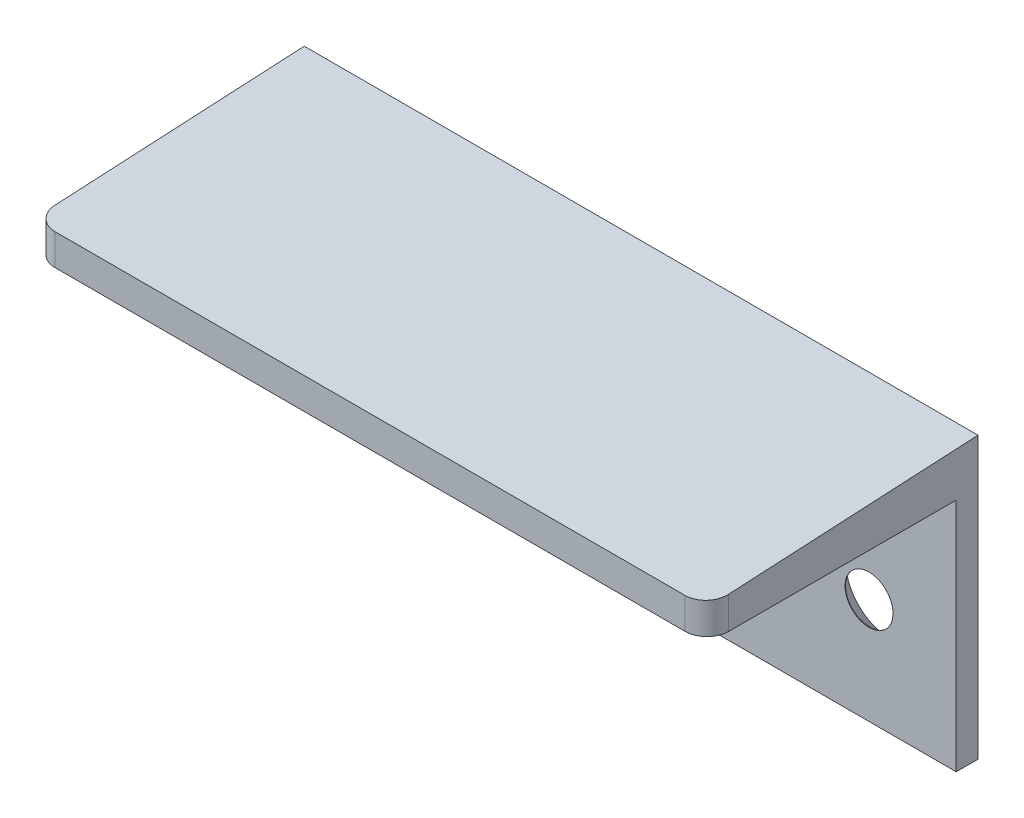
from build123d import *

# Parameters (mm, degrees)
SKETCH1_W                                       = 77.3
SKETCH1_H                                       = 32.2
BOSS_EXTRUDE1_DEPTH                             = 2.5
SKETCH3_W                                       = 77.3
SKETCH3_H                                       = 5.2
BOSS_EXTRUDE2_DEPTH                             = 28.599
FILLET1_R                                       = 2.5
SKETCH4_W                                       = 77.3
SKETCH4_H                                       = 37.342788029
CUT_REVOLVE2_ANGLE                              = 3
CSK_FOR_M5_FLAT_HEAD_MACHINE_SCREW1_D           = 5.5
CSK_FOR_M5_FLAT_HEAD_MACHINE_SCREW1_DEPTH       = 12.4
CSK_FOR_M5_FLAT_HEAD_MACHINE_SCREW1_CSINK_D     = 10.4
CSK_FOR_M5_FLAT_HEAD_MACHINE_SCREW1_CSINK_ANGLE = 90
CSK_FOR_M5_FLAT_HEAD_MACHINE_SCREW1_TIP         = 1.652366702


with BuildPart() as part:
    # Sketch1 → Boss-Extrude1 (new body)
    with BuildSketch(Plane.XY):
        Rectangle(SKETCH1_W, SKETCH1_H)
    extrude(amount=BOSS_EXTRUDE1_DEPTH)

    # Sketch3 → Boss-Extrude2 (add)
    with BuildSketch(Plane.XY.offset(2.5)):
        with Locations((0, 13.5)):
            Rectangle(SKETCH3_W, SKETCH3_H)
    extrude(amount=BOSS_EXTRUDE2_DEPTH)

    # Fillet1
    fillet1_edges = [part.edges().sort_by_distance(p)[0] for p in [
        (-38.65, 13.5, 31.099),
        (38.65, 13.5, 31.099),
    ]]
    fillet(fillet1_edges, radius=FILLET1_R)

    # Sketch4 → Cut-Revolve2 (revolve, cut)
    with BuildSketch(Plane(origin=(0, 16.1, 0), x_dir=(1, 0, 0), z_dir=(0, 1, 0))):
        with Locations((0, -18.671394015)):
            Rectangle(SKETCH4_W, SKETCH4_H)
    revolve(axis=Axis((-38.65, 16.1, 0), (1, 0, 0)), revolution_arc=CUT_REVOLVE2_ANGLE, mode=Mode.SUBTRACT)

    # CSK for M5 Flat Head Machine Screw1
    with Locations(Plane(origin=(0, 0, 0), x_dir=(-1, 0, 0), z_dir=(0, 0, -1))):
        with Locations((-28.65, -4), (28.65, -4)):
            CounterSinkHole(CSK_FOR_M5_FLAT_HEAD_MACHINE_SCREW1_D / 2, CSK_FOR_M5_FLAT_HEAD_MACHINE_SCREW1_CSINK_D / 2, depth=CSK_FOR_M5_FLAT_HEAD_MACHINE_SCREW1_DEPTH, counter_sink_angle=CSK_FOR_M5_FLAT_HEAD_MACHINE_SCREW1_CSINK_ANGLE)
            with Locations((0, 0, -(CSK_FOR_M5_FLAT_HEAD_MACHINE_SCREW1_DEPTH + CSK_FOR_M5_FLAT_HEAD_MACHINE_SCREW1_TIP / 2))):  # 118° drill point
                Cone(0, CSK_FOR_M5_FLAT_HEAD_MACHINE_SCREW1_D / 2, CSK_FOR_M5_FLAT_HEAD_MACHINE_SCREW1_TIP, mode=Mode.SUBTRACT)


solid = part.part
